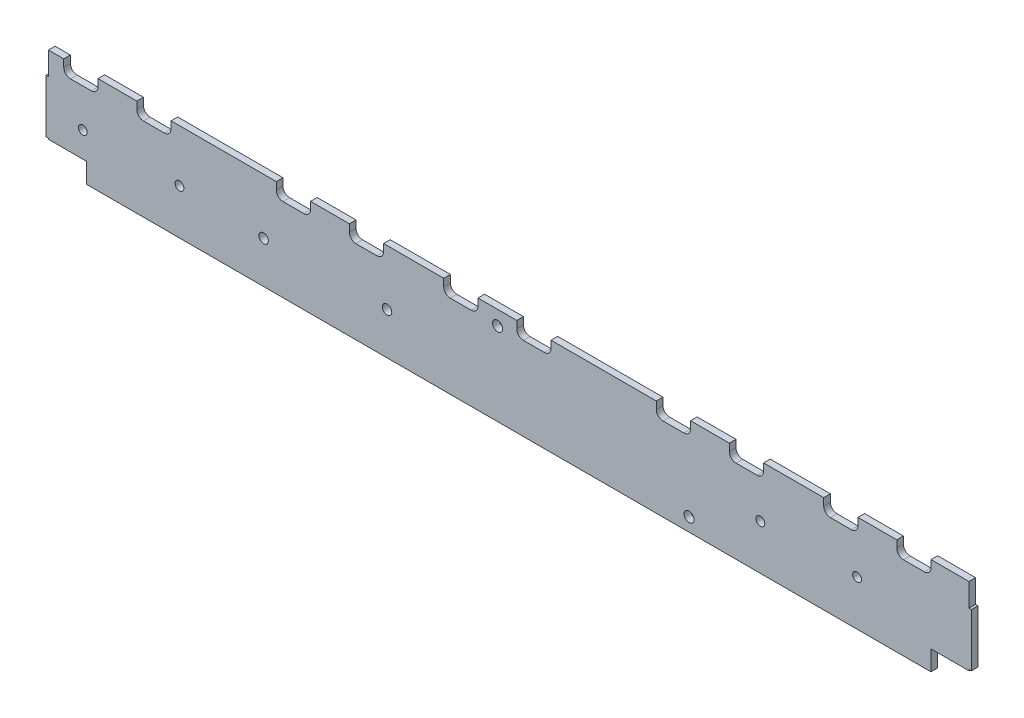
from build123d import *

# Parameters (mm, degrees)
BOSS_EXTRUDE1_DEPTH = 3.175
SKETCH4_R           = 2.1
SKETCH4_R_2         = 2.25
SKETCH4_R_3         = 2.4
CUT_EXTRUDE2_DEPTH  = 343.045224939


with BuildPart() as part:
    # Sketch2 → Boss-Extrude1 (new body)
    with BuildSketch(Plane.XY):
        with BuildLine():
            Line((-166.376823509, -157.21600002), (-166.376823509, -167.12200002))
            Line((-166.376823509, -167.12200002), (-166.376823509, -168.26500002))
            Line((-166.376823509, -168.26500002), (-167.519823509, -168.26500002))
            Line((-167.519823509, -168.26500002), (-167.519823509, -187.31500002))
            Line((-167.519823509, -187.31500002), (-167.519823509, -193.66500002))
            Line((-167.519823509, -193.66500002), (-166.376823509, -193.66500002))
            Line((-166.376823509, -193.66500002), (-166.376823509, -194.18100002))
            Line((-166.376823509, -194.18100002), (-148.199823509, -194.18100002))
            Line((-148.199823509, -194.18100002), (-148.199823509, -203.71400002))
            Line((-148.199823509, -203.71400002), (255.426176451, -203.71400002))
            Line((255.426176451, -203.71400002), (255.426176451, -194.18100002))
            Line((255.426176451, -194.18100002), (273.603176451, -194.18100002))
            Line((273.603176451, -194.18100002), (273.603176451, -193.66500002))
            Line((273.603176451, -193.66500002), (274.746176451, -193.66500002))
            Line((274.746176451, -193.66500002), (274.746176451, -174.61500002))
            Line((274.746176451, -174.61500002), (274.746176451, -168.26500002))
            Line((274.746176451, -168.26500002), (273.603176451, -168.26500002))
            Line((273.603176451, -168.26500002), (273.603176451, -167.12200002))
            Line((273.603176451, -167.12200002), (273.603176451, -157.21600002))
            Line((273.603176451, -157.21600002), (255.463301471, -157.21600002))
            Line((255.463301471, -157.21600002), (255.463301471, -160.70800002))
            ThreePointArc((255.463301471, -160.70800002), (254.533365501, -162.95306405), (252.288301471, -163.88300002))
            Line((252.288301471, -163.88300002), (242.288301471, -163.88300002))
            ThreePointArc((242.288301471, -163.88300002), (240.04323744, -162.95306405), (239.113301471, -160.70800002))
            Line((239.113301471, -160.70800002), (239.113301471, -157.21600002))
            Line((239.113301471, -157.21600002), (220.538301471, -157.21600002))
            Line((220.538301471, -157.21600002), (220.538301471, -160.70800002))
            ThreePointArc((220.538301471, -160.70800002), (219.608365501, -162.95306405), (217.363301471, -163.88300002))
            Line((217.363301471, -163.88300002), (207.363301471, -163.88300002))
            ThreePointArc((207.363301471, -163.88300002), (205.11823744, -162.95306405), (204.188301471, -160.70800002))
            Line((204.188301471, -160.70800002), (204.188301471, -157.21600002))
            Line((204.188301471, -157.21600002), (175.452051471, -157.21600002))
            Line((175.452051471, -157.21600002), (175.452051471, -160.70800002))
            ThreePointArc((175.452051471, -160.70800002), (174.522115501, -162.95306405), (172.277051471, -163.88300002))
            Line((172.277051471, -163.88300002), (162.277051471, -163.88300002))
            ThreePointArc((162.277051471, -163.88300002), (160.03198744, -162.95306405), (159.102051471, -160.70800002))
            Line((159.102051471, -160.70800002), (159.102051471, -157.21600002))
            Line((159.102051471, -157.21600002), (140.527051471, -157.21600002))
            Line((140.527051471, -157.21600002), (140.527051471, -160.70800002))
            ThreePointArc((140.527051471, -160.70800002), (139.597115501, -162.95306405), (137.352051471, -163.88300002))
            Line((137.352051471, -163.88300002), (127.352051471, -163.88300002))
            ThreePointArc((127.352051471, -163.88300002), (125.10698744, -162.95306405), (124.177051471, -160.70800002))
            Line((124.177051471, -160.70800002), (124.177051471, -157.21600002))
            Line((124.177051471, -157.21600002), (73.849301471, -157.21600002))
            Line((73.849301471, -157.21600002), (73.849301471, -160.70800002))
            ThreePointArc((73.849301471, -160.70800002), (72.919365501, -162.95306405), (70.674301471, -163.88300002))
            Line((70.674301471, -163.88300002), (60.674301471, -163.88300002))
            ThreePointArc((60.674301471, -163.88300002), (58.42923744, -162.95306405), (57.499301471, -160.70800002))
            Line((57.499301471, -160.70800002), (57.499301471, -157.21600002))
            Line((57.499301471, -157.21600002), (38.924301471, -157.21600002))
            Line((38.924301471, -157.21600002), (38.924301471, -160.70800002))
            ThreePointArc((38.924301471, -160.70800002), (37.994365501, -162.95306405), (35.749301471, -163.88300002))
            Line((35.749301471, -163.88300002), (25.749301471, -163.88300002))
            ThreePointArc((25.749301471, -163.88300002), (23.50423744, -162.95306405), (22.574301471, -160.70800002))
            Line((22.574301471, -160.70800002), (22.574301471, -157.21600002))
            Line((22.574301471, -157.21600002), (-6.161948529, -157.21600002))
            Line((-6.161948529, -157.21600002), (-6.161948529, -160.70800002))
            ThreePointArc((-6.161948529, -160.70800002), (-7.091884499, -162.95306405), (-9.336948529, -163.88300002))
            Line((-9.336948529, -163.88300002), (-19.336948529, -163.88300002))
            ThreePointArc((-19.336948529, -163.88300002), (-21.58201256, -162.95306405), (-22.511948529, -160.70800002))
            Line((-22.511948529, -160.70800002), (-22.511948529, -157.21600002))
            Line((-22.511948529, -157.21600002), (-41.086948529, -157.21600002))
            Line((-41.086948529, -157.21600002), (-41.086948529, -160.70800002))
            ThreePointArc((-41.086948529, -160.70800002), (-42.016884499, -162.95306405), (-44.261948529, -163.88300002))
            Line((-44.261948529, -163.88300002), (-54.261948529, -163.88300002))
            ThreePointArc((-54.261948529, -163.88300002), (-56.50701256, -162.95306405), (-57.436948529, -160.70800002))
            Line((-57.436948529, -160.70800002), (-57.436948529, -157.21600002))
            Line((-57.436948529, -157.21600002), (-107.764698529, -157.21600002))
            Line((-107.764698529, -157.21600002), (-107.764698529, -160.70800002))
            ThreePointArc((-107.764698529, -160.70800002), (-108.694634499, -162.95306405), (-110.939698529, -163.88300002))
            Line((-110.939698529, -163.88300002), (-120.939698529, -163.88300002))
            ThreePointArc((-120.939698529, -163.88300002), (-123.18476256, -162.95306405), (-124.114698529, -160.70800002))
            Line((-124.114698529, -160.70800002), (-124.114698529, -157.21600002))
            Line((-124.114698529, -157.21600002), (-142.689698529, -157.21600002))
            Line((-142.689698529, -157.21600002), (-142.689698529, -160.70800002))
            ThreePointArc((-142.689698529, -160.70800002), (-143.619634499, -162.95306405), (-145.864698529, -163.88300002))
            Line((-145.864698529, -163.88300002), (-155.864698529, -163.88300002))
            ThreePointArc((-155.864698529, -163.88300002), (-158.10976256, -162.95306405), (-159.039698529, -160.70800002))
            Line((-159.039698529, -160.70800002), (-159.039698529, -157.21600002))
            Line((-159.039698529, -157.21600002), (-166.376823509, -157.21600002))
        make_face()
    extrude(amount=BOSS_EXTRUDE1_DEPTH)

    # Sketch4 → Cut-Extrude2 (cut, through all)
    with BuildSketch(Plane.XY.offset(3.175)):
        with Locations((220.106176451, -182.10474)):
            Circle(SKETCH4_R)
        with Locations((173.906176451, -182.10474)):
            Circle(SKETCH4_R)
        with Locations((-4.519823509, -183.71400002)):
            Circle(SKETCH4_R_2)
        with Locations((-63.519823509, -183.71400002)):
            Circle(SKETCH4_R_2)
        with Locations((-103.723323529, -182.10474)):
            Circle(SKETCH4_R)
        with Locations((-149.923323529, -182.10474)):
            Circle(SKETCH4_R)
        with Locations((48.318076451, -164.10474)):
            Circle(SKETCH4_R_3)
        with Locations((139.818076451, -197.329197785)):
            Circle(SKETCH4_R_3)
    extrude(amount=-CUT_EXTRUDE2_DEPTH, mode=Mode.SUBTRACT)


solid = part.part
